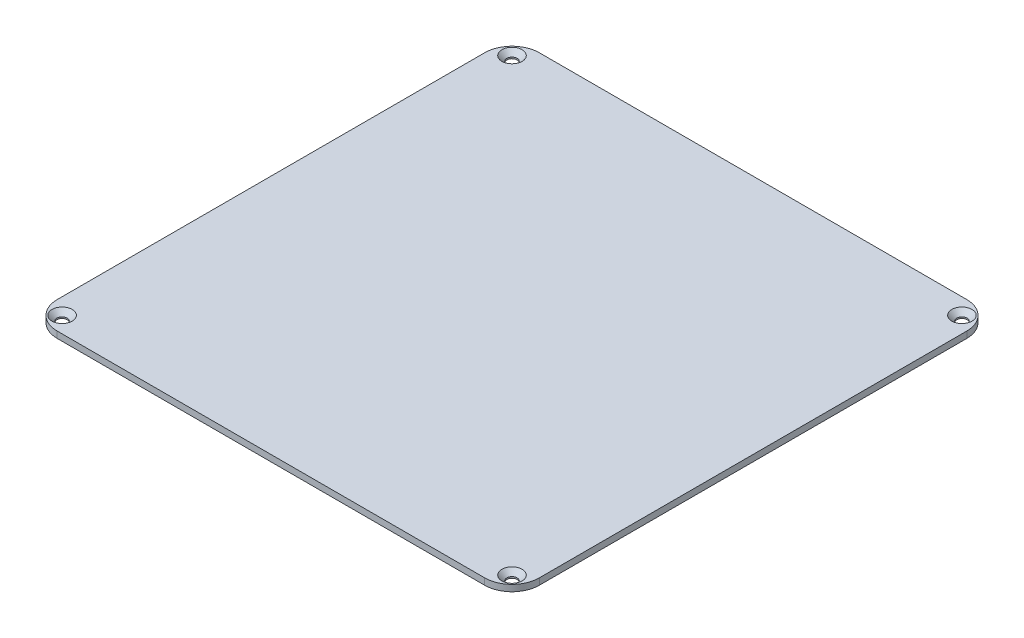
from build123d import *

# Parameters (mm, degrees)
SKIZZE1_W                                   = 300
SKIZZE1_H                                   = 300
AUFSATZ_LINEAR_AUSTRAGEN1_DEPTH             = 4
VERRUNDUNG1_R                               = 17
FORMSENKUNG_F_R_M6_SENKSCHRAUBE_MIT_2_COUNT = 2
FORMSENKUNG_F_R_M6_SENKSCHRAUBE_MIT_2_PITCH = 280
FORMSENKUNG_F_R_M6_SENKSCHRAUBE_MIT_3_COUNT = 2
FORMSENKUNG_F_R_M6_SENKSCHRAUBE_MIT_3_PITCH = 395.979797464
FORMSENKUNG_F_R_M6_SENKSCHRAUBE_MIT_4_COUNT = 2
FORMSENKUNG_F_R_M6_SENKSCHRAUBE_MIT_4_PITCH = 280


with BuildPart() as part:
    # Skizze1 → Aufsatz-Linear austragen1 (new body)
    with BuildSketch(Plane(origin=(0, 0, 0), x_dir=(1, 0, 0), z_dir=(0, 1, 0))):
        with Locations((150, 150)):
            Rectangle(SKIZZE1_W, SKIZZE1_H)
    extrude(amount=AUFSATZ_LINEAR_AUSTRAGEN1_DEPTH)

    # Verrundung1
    verrundung1_edges = [part.edges().sort_by_distance(p)[0] for p in [
        (0, 2, -300),
        (300, 2, -300),
        (300, 2, 0),
        (0, 2, 0),
    ]]
    fillet(verrundung1_edges, radius=VERRUNDUNG1_R)

    # Skizze2 → Formsenkung für M6 Senkschraube mit Schlitz/Kreuzschlitz1 (revolve, cut)
    with BuildSketch(Plane(origin=(290, 4, -10), x_dir=(0, 0, 1), z_dir=(1, 0, 0))):
        Polygon((0, 0), (0, 4), (3.2, 4), (3.2, 3.1), (6.3, 0), align=None)
    formsenkung_f_r_m6_senkschraube_mit_schl = revolve(axis=Axis((290, 10.35, -10), (0, -1, 0)), mode=Mode.SUBTRACT)

    # Formsenkung f_r M6 Senkschraube mit  2: Formsenkung für M6 Senkschraube mit Schlitz/Kreuzschlitz1 ×2
    with Locations(*[(-i * FORMSENKUNG_F_R_M6_SENKSCHRAUBE_MIT_2_PITCH, 0, 0) for i in range(1, FORMSENKUNG_F_R_M6_SENKSCHRAUBE_MIT_2_COUNT)]):
        add(formsenkung_f_r_m6_senkschraube_mit_schl, mode=Mode.SUBTRACT)

    # Formsenkung f_r M6 Senkschraube mit  3: Formsenkung für M6 Senkschraube mit Schlitz/Kreuzschlitz1 ×2
    with Locations(*[Vector(-0.7071067811865475, 0, -0.7071067811865476) * (i * FORMSENKUNG_F_R_M6_SENKSCHRAUBE_MIT_3_PITCH) for i in range(1, FORMSENKUNG_F_R_M6_SENKSCHRAUBE_MIT_3_COUNT)]):
        add(formsenkung_f_r_m6_senkschraube_mit_schl, mode=Mode.SUBTRACT)

    # Formsenkung f_r M6 Senkschraube mit  4: Formsenkung für M6 Senkschraube mit Schlitz/Kreuzschlitz1 ×2
    with Locations(*[(0, 0, -i * FORMSENKUNG_F_R_M6_SENKSCHRAUBE_MIT_4_PITCH) for i in range(1, FORMSENKUNG_F_R_M6_SENKSCHRAUBE_MIT_4_COUNT)]):
        add(formsenkung_f_r_m6_senkschraube_mit_schl, mode=Mode.SUBTRACT)


solid = part.part
